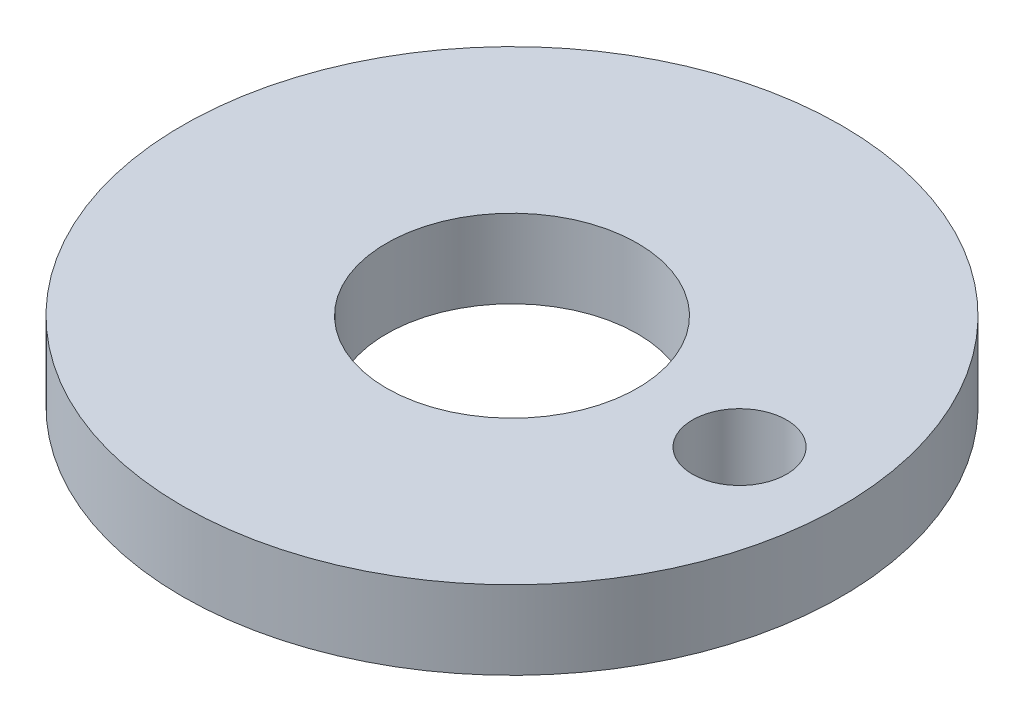
from build123d import *

# Parameters (mm, degrees)
SKETCH1_R           = 10.5
BOSS_EXTRUDE1_DEPTH = 2.5
SKETCH2_R           = 4
SKETCH2_R_2         = 1.5
CUT_EXTRUDE1_DEPTH  = 10


with BuildPart() as part:
    # Sketch1 → Boss-Extrude1 (new body)
    with BuildSketch(Plane(origin=(0, 0, 0), x_dir=(1, 0, 0), z_dir=(0, 1, 0))):
        with Locations(Location((0, 0, 0), (0, 0, 270))):
            Circle(SKETCH1_R)
    extrude(amount=BOSS_EXTRUDE1_DEPTH)

    # Sketch2 → Cut-Extrude1 (cut)
    with BuildSketch(Plane(origin=(0, 2.5, 0), x_dir=(1, 0, 0), z_dir=(0, 1, 0))):
        with Locations(Location((0, 0, 0), (0, 0, 270))):
            Circle(SKETCH2_R)
        with Locations(Location((7.25, 0, 0), (0, 0, 270))):
            Circle(SKETCH2_R_2)
    extrude(amount=-CUT_EXTRUDE1_DEPTH, mode=Mode.SUBTRACT)


solid = part.part
